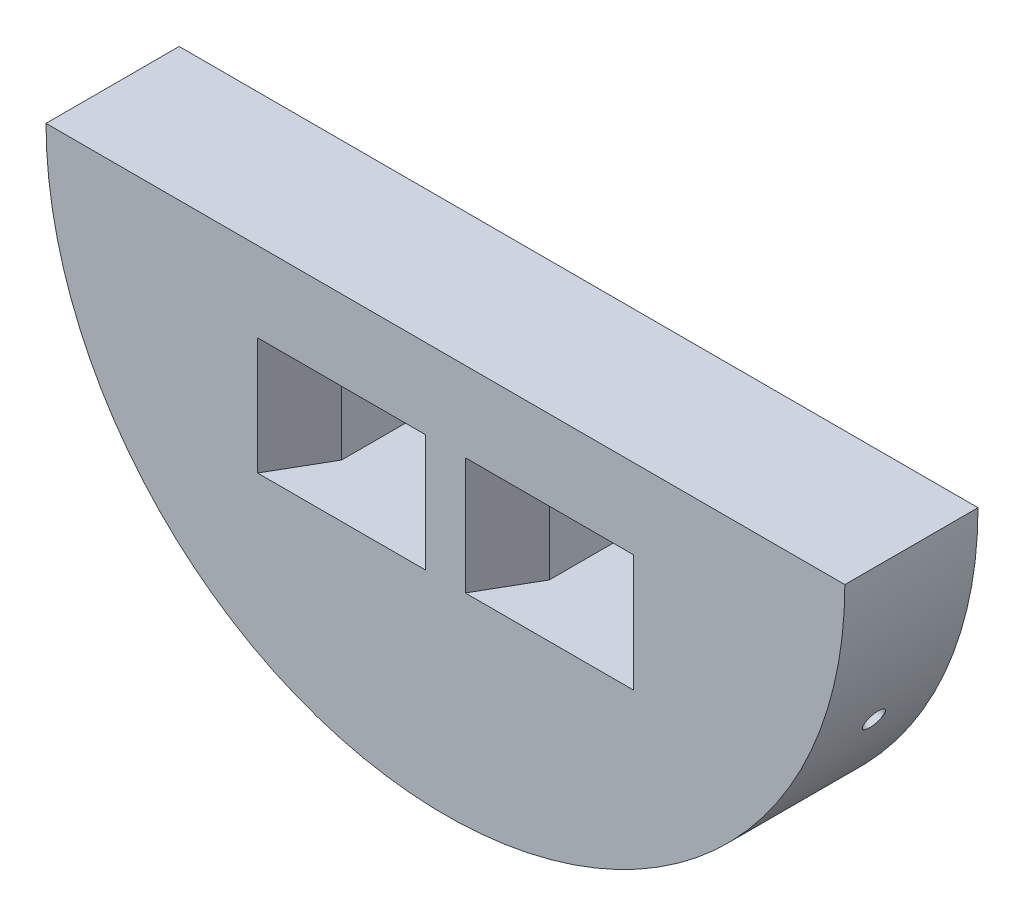
from build123d import *
from OCP.BRepFilletAPI import BRepFilletAPI_MakeChamfer

# Parameters (mm, degrees)
SKETCH1_W           = 20
SKETCH1_H           = 22
BOSS_EXTRUDE1_DEPTH = 25
CIRPATTERN1_COUNT   = 5
CIRPATTERN1_ANGLE   = 130
CHAMFER1_SIZE       = 15
CHAMFER1_SIZE2      = 8.660254038
CHAMFER3_SIZE       = 10
CHAMFER3_SIZE2      = 5.773502692


with BuildPart() as part:
    # Sketch1 → Boss-Extrude1 (new body)
    with BuildSketch(Plane.XY):
        with BuildLine():
            Line((-150, 0), (0, 0))
            ThreePointArc((0, 0), (-75, -75), (-150, 0))
        make_face()
        with Locations((-55.5, -26)):
            Rectangle(SKETCH1_W, SKETCH1_H, mode=Mode.SUBTRACT)
        with Locations((-94.5, -26)):
            Rectangle(SKETCH1_W, SKETCH1_H, mode=Mode.SUBTRACT)
    extrude(amount=BOSS_EXTRUDE1_DEPTH)

    # Sketch4 → Ø4.0mm Dowel Hole2 (revolve, cut)
    with BuildSketch(Plane(origin=(-7.026915972, -31.696369631, 12.5), x_dir=(0.4226182617407001, 0.9063077870366498, 0), z_dir=(0, 0, 1))):
        Polygon((0, 0), (0, 17.201721238), (2, 16), (2, 0.025), (2.025, 0), align=None)
    f_4_0mm_dowel_hole2 = revolve(axis=Axis((-1.271861525, -34.379995593, 12.5), (-0.9063077870366496, 0.42261826174070005, 0)), mode=Mode.SUBTRACT)

    # CirPattern1: Ø4.0mm Dowel Hole2 ×5 about axis
    cirpattern1_axis = Axis((-75, 0, 0), (0, 0, -1))
    for i in range(1, CIRPATTERN1_COUNT):
        add(f_4_0mm_dowel_hole2.rotate(cirpattern1_axis, i * CIRPATTERN1_ANGLE / (CIRPATTERN1_COUNT - 1)), mode=Mode.SUBTRACT)

    # Chamfer1: one chamfer whose edges measure the first distance from different faces: ONE call of the kernel's chamfer builder (chamfer() names one face for all edges)
    chamfer1_edges_1 = [part.edges().sort_by_distance(p)[0] for p in [
        (-55.5, -15, 0),
    ]]
    chamfer1_side_1 = [part.faces().sort_by_distance(p)[0] for p in [
        (-55.5, -15, 12.5),
    ]]
    chamfer1_edges_2 = [part.edges().sort_by_distance(p)[0] for p in [
        (-94.5, -15, 0),
    ]]
    chamfer1_side_2 = [part.faces().sort_by_distance(p)[0] for p in [
        (-94.5, -15, 12.5),
    ]]
    chamfer1 = BRepFilletAPI_MakeChamfer(part.part.solid().wrapped)
    for e in chamfer1_edges_1:
        chamfer1.Add(CHAMFER1_SIZE, CHAMFER1_SIZE2, e.wrapped, chamfer1_side_1[0].wrapped)  # the first distance lies on this face
    for e in chamfer1_edges_2:
        chamfer1.Add(CHAMFER1_SIZE, CHAMFER1_SIZE2, e.wrapped, chamfer1_side_2[0].wrapped)  # the first distance lies on this face
    add(Compound.cast(chamfer1.Shape()), mode=Mode.REPLACE)

    # Chamfer3: one chamfer whose edges measure the first distance from different faces: ONE call of the kernel's chamfer builder (chamfer() names one face for all edges)
    chamfer3_edges_1 = [part.edges().sort_by_distance(p)[0] for p in [
        (-104.5, -26, 25),
    ]]
    chamfer3_side_1 = [part.faces().sort_by_distance(p)[0] for p in [
        (-104.5, -24.533265853, 11.707841645),
    ]]
    chamfer3_edges_2 = [part.edges().sort_by_distance(p)[0] for p in [
        (-84.5, -26, 25),
    ]]
    chamfer3_side_2 = [part.faces().sort_by_distance(p)[0] for p in [
        (-84.5, -24.533265853, 11.707841645),
    ]]
    chamfer3_edges_3 = [part.edges().sort_by_distance(p)[0] for p in [
        (-45.5, -26, 25),
    ]]
    chamfer3_side_3 = [part.faces().sort_by_distance(p)[0] for p in [
        (-45.5, -24.533265853, 11.707841645),
    ]]
    chamfer3_edges_4 = [part.edges().sort_by_distance(p)[0] for p in [
        (-65.5, -26, 25),
    ]]
    chamfer3_side_4 = [part.faces().sort_by_distance(p)[0] for p in [
        (-65.5, -24.533265853, 11.707841645),
    ]]
    chamfer3 = BRepFilletAPI_MakeChamfer(part.part.solid().wrapped)
    for e in chamfer3_edges_1:
        chamfer3.Add(CHAMFER3_SIZE, CHAMFER3_SIZE2, e.wrapped, chamfer3_side_1[0].wrapped)  # the first distance lies on this face
    for e in chamfer3_edges_2:
        chamfer3.Add(CHAMFER3_SIZE, CHAMFER3_SIZE2, e.wrapped, chamfer3_side_2[0].wrapped)  # the first distance lies on this face
    for e in chamfer3_edges_3:
        chamfer3.Add(CHAMFER3_SIZE, CHAMFER3_SIZE2, e.wrapped, chamfer3_side_3[0].wrapped)  # the first distance lies on this face
    for e in chamfer3_edges_4:
        chamfer3.Add(CHAMFER3_SIZE, CHAMFER3_SIZE2, e.wrapped, chamfer3_side_4[0].wrapped)  # the first distance lies on this face
    add(Compound.cast(chamfer3.Shape()), mode=Mode.REPLACE)


solid = part.part
